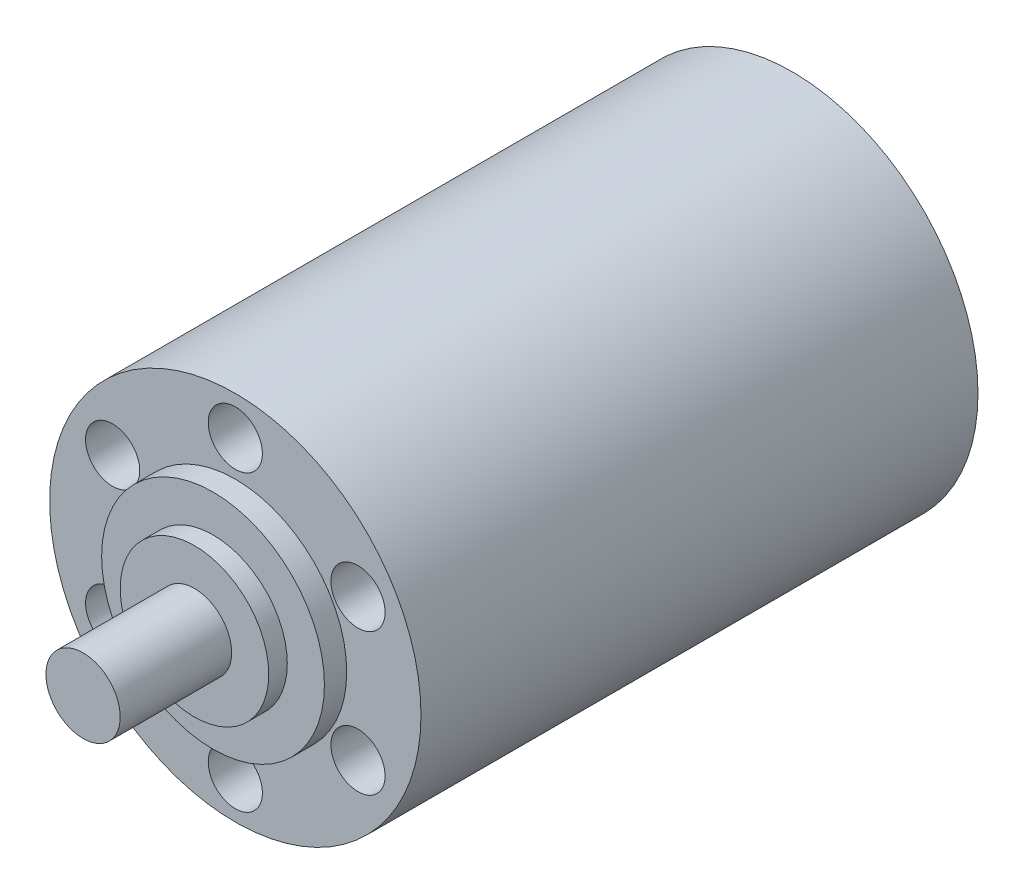
from build123d import *

# Parameters (mm, degrees)
SKETCH_4_R          = 50
EXTRUDE_1_DEPTH     = 150
SKETCH_5_R          = 30
EXTRUDE_2_DEPTH     = 6
SKETCH_6_R          = 20
EXTRUDE_3_DEPTH     = 5
SKETCH_7_R          = 10
EXTRUDE_4_DEPTH     = 30
SKETCH_8_R          = 7.293017107
CUT_EXTRUDE_1_DEPTH = 20


with BuildPart() as part:
    # 草图4 → 凸台-拉伸1 (new body)
    with BuildSketch(Plane.XY):
        Circle(SKETCH_4_R)
    extrude(amount=EXTRUDE_1_DEPTH)

    # 草图5 → 凸台-拉伸2 (add)
    with BuildSketch(Plane.XY.offset(150)):
        Circle(SKETCH_5_R)
    extrude(amount=EXTRUDE_2_DEPTH)

    # 草图6 → 凸台-拉伸3 (add)
    with BuildSketch(Plane.XY.offset(156)):
        Circle(SKETCH_6_R)
    extrude(amount=EXTRUDE_3_DEPTH)

    # 草图7 → 凸台-拉伸4 (add)
    with BuildSketch(Plane.XY.offset(161)):
        Circle(SKETCH_7_R)
    extrude(amount=EXTRUDE_4_DEPTH)

    # 草图8 → 切除-拉伸1 (cut)
    with BuildSketch(Plane.XY.offset(150)):
        with Locations((0, 39.574124617)):
            Circle(SKETCH_8_R)
        with Locations((33.03726858, 19.074075908)):
            Circle(SKETCH_8_R)
        with Locations(Location((0, -39.574124617, 0), (0, 0, 180))):
            Circle(SKETCH_8_R)
        with Locations(Location((-33.03726858, 19.074075908, 0), (0, 0, 180))):
            Circle(SKETCH_8_R)
        with Locations(Location((33.03726858, -19.074075908, 0), (0, 0, 180))):
            Circle(SKETCH_8_R)
        with Locations((-33.03726858, -19.074075908)):
            Circle(SKETCH_8_R)
    extrude(amount=-CUT_EXTRUDE_1_DEPTH, mode=Mode.SUBTRACT)


solid = part.part
